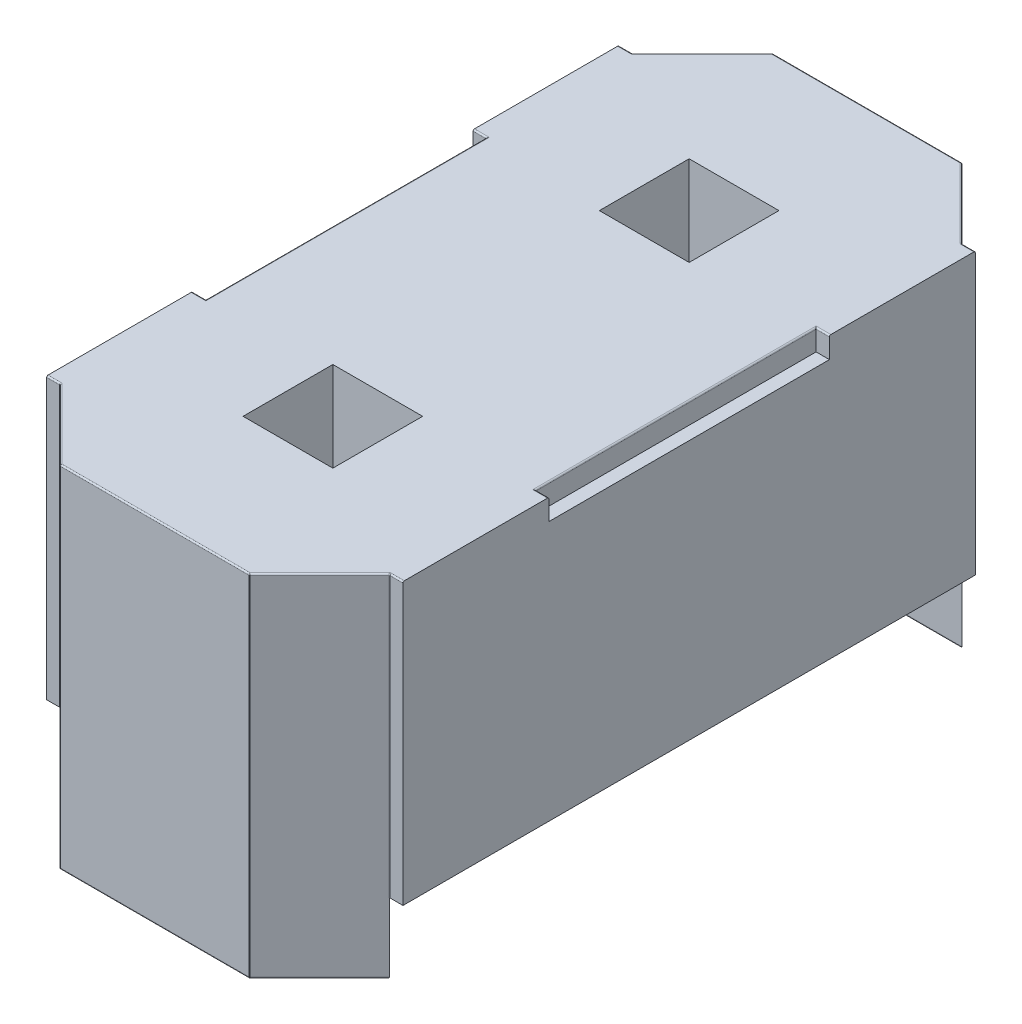
from build123d import *

# Parameters (mm, degrees)
BOSS_EXTRUDE1_DEPTH     = 2.5
SKETCH7_W               = 0.64
SKETCH7_H               = 0.64
CUT_EXTRUDE1_DEPTH      = 4.752629078
SKETCH8_W               = 0.095
SKETCH8_H               = 4.08
BOSS_EXTRUDE2_DEPTH     = 2.5
SKETCH9_W               = 0.095
SKETCH9_H               = 2
CUT_EXTRUDE2_DEPTH      = 0.15
CUT_EXTRUDE3_DEPTH      = 5.376436907
CUT_EXTRUDE3_DEPTH_BACK = 5.376436907
SKETCH12_W              = 4.08
SKETCH12_H              = 0.5
CHAMFER1_SIZE           = 0.4
FILLET1_R               = 0.01


with BuildPart() as part:
    # Sketch5 → Boss-Extrude1 (new body)
    with BuildSketch(Plane(origin=(0, 0, 0), x_dir=(1, 0, 0), z_dir=(0, 1, 0))):
        Polygon((-0.675, 2.54), (-1.175, 2.04), (-1.175, -2.04), (-0.675, -2.54), (0.675, -2.54), (1.175, -2.04), (1.175, 2.04), (0.675, 2.54), align=None)
    extrude(amount=BOSS_EXTRUDE1_DEPTH)

    # Sketch7 → Cut-Extrude1 (cut, through all)
    with BuildSketch(Plane(origin=(0, 2.5, 0), x_dir=(1, 0, 0), z_dir=(0, 1, 0))):
        with Locations((0, 1.27)):
            Rectangle(SKETCH7_W, SKETCH7_H)
        with Locations((0, -1.27)):
            Rectangle(SKETCH7_W, SKETCH7_H)
    extrude(amount=-CUT_EXTRUDE1_DEPTH, mode=Mode.SUBTRACT)

    # Sketch8 → Boss-Extrude2 (add)
    with BuildSketch(Plane(origin=(0, 2.5, 0), x_dir=(1, 0, 0), z_dir=(0, 1, 0))):
        with Locations((-1.2225, 0)):
            Rectangle(SKETCH8_W, SKETCH8_H)
        with Locations((1.2225, 0)):
            Rectangle(SKETCH8_W, SKETCH8_H)
    extrude(amount=-BOSS_EXTRUDE2_DEPTH)

    # Sketch9 → Cut-Extrude2 (cut)
    with BuildSketch(Plane(origin=(0, 2.5, 0), x_dir=(1, 0, 0), z_dir=(0, 1, 0))):
        with Locations((-1.2225, 0)):
            Rectangle(SKETCH9_W, SKETCH9_H)
        with Locations((1.2225, 0)):
            Rectangle(SKETCH9_W, SKETCH9_H)
    extrude(amount=-CUT_EXTRUDE2_DEPTH, mode=Mode.SUBTRACT)

    # Sketch12 → Cut-Extrude3 (cut, two sides: drawn at the far end of the back side and taken through both)
    with BuildSketch(Plane(origin=(1.27, 0, 0), x_dir=(0, 0, -1), z_dir=(1, 0, 0)).offset(-CUT_EXTRUDE3_DEPTH_BACK)):
        with Locations((0, 0.25)):
            Rectangle(SKETCH12_W, SKETCH12_H)
    extrude(amount=CUT_EXTRUDE3_DEPTH + CUT_EXTRUDE3_DEPTH_BACK, mode=Mode.SUBTRACT)

    # Chamfer1
    chamfer1_edges = [part.edges().sort_by_distance(p)[0] for p in [
        (0, 0.5, -1.59),
        (0.32, 0.5, -1.27),
        (0, 0.5, -0.95),
        (-0.32, 0.5, -1.27),
        (0, 0.5, 1.59),
        (-0.32, 0.5, 1.27),
        (0, 0.5, 0.95),
        (0.32, 0.5, 1.27),
    ]]
    chamfer(chamfer1_edges, length=CHAMFER1_SIZE)

    # Fillet1
    fillet1_edges = [part.edges().sort_by_distance(p)[0] for p in [
        (-1.2225, 2.5, -2.04),
        (-0.925, 2.5, -2.29),
        (0, 0, -2.54),
        (0, 2.5, -2.54),
        (0.925, 2.5, -2.29),
        (1.2225, 2.5, -2.04),
        (1.2225, 2.5, -1),
        (1.175, 2.5, 0),
        (1.2225, 2.5, 1),
        (1.2225, 2.5, 2.04),
        (0.925, 2.5, 2.29),
        (0, 0, 2.54),
        (0, 2.5, 2.54),
        (-0.925, 2.5, 2.29),
        (-1.2225, 2.5, 2.04),
        (-1.2225, 2.5, 1),
        (-1.175, 2.5, 0),
        (-1.2225, 2.5, -1),
        (0.925, 0, -2.29),
        (-0.925, 0, -2.29),
        (0, 0, -2.04),
        (-0.925, 0, 2.29),
        (0.925, 0, 2.29),
        (0, 0, 2.04),
        (0.675, 1.25, -2.54),
        (-0.675, 1.25, -2.54),
        (-0.675, 1.25, 2.54),
        (0.675, 1.25, 2.54),
        (-1.175, 1.5, -2.04),
        (-1.175, 1.5, 2.04),
        (1.175, 1.5, -2.04),
        (1.175, 1.5, 2.04),
    ]]
    fillet(fillet1_edges, radius=FILLET1_R)


solid = part.part
